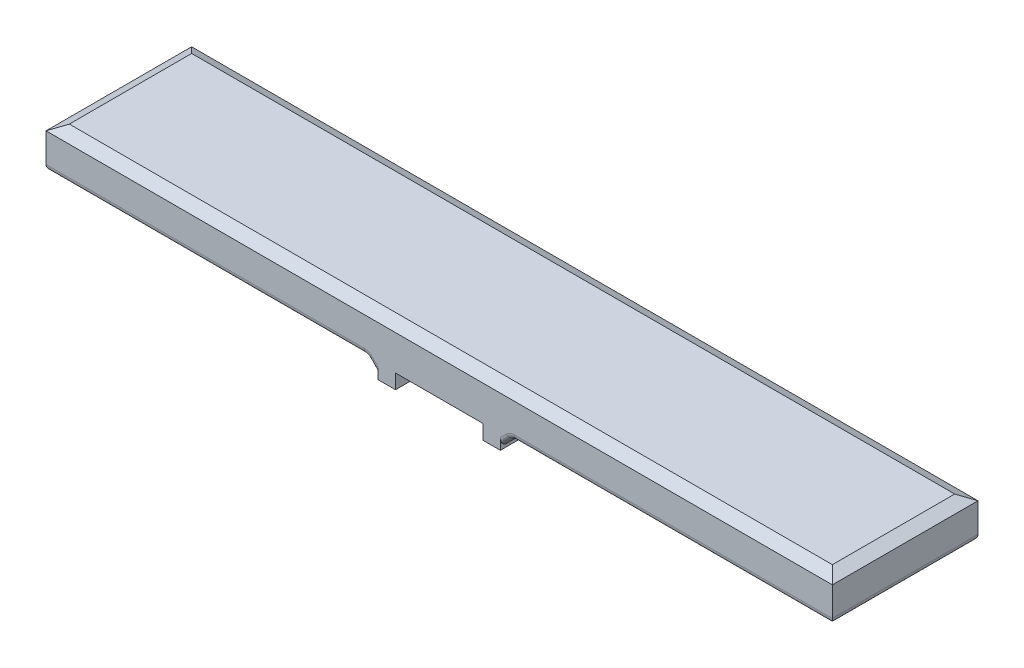
from build123d import *
from OCP.BRepFilletAPI import BRepFilletAPI_MakeChamfer

# Parameters (mm, degrees)
SKETCH1_W           = 1350
SKETCH1_H           = 250
BOSS_EXTRUDE1_DEPTH = 70
CHAMFER1_SIZE       = 10
CHAMFER1_SIZE2      = 20
SHELL1_T            = 10
SKETCH2_W           = 30
SKETCH2_H           = 250
BOSS_EXTRUDE2_DEPTH = 25
CHAMFER2_SIZE       = 20
FILLET1_R           = 10
SKETCH3_R           = 10
BOSS_EXTRUDE3_DEPTH = 25
CHAMFER3_SIZE       = 3


with BuildPart() as part:
    # Sketch1 → Boss-Extrude1 (new body)
    with BuildSketch(Plane(origin=(0, 0, 0), x_dir=(1, 0, 0), z_dir=(0, 1, 0))):
        Rectangle(SKETCH1_W, SKETCH1_H)
    extrude(amount=BOSS_EXTRUDE1_DEPTH)

    # Chamfer1: one chamfer whose edges measure the first distance from different faces: ONE call of the kernel's chamfer builder (chamfer() names one face for all edges)
    chamfer1_edges_1 = [part.edges().sort_by_distance(p)[0] for p in [
        (675, 70, 0),
    ]]
    chamfer1_side_1 = [part.faces().sort_by_distance(p)[0] for p in [
        (675, 35, 0),
    ]]
    chamfer1_edges_2 = [part.edges().sort_by_distance(p)[0] for p in [
        (0, 70, -125),
    ]]
    chamfer1_side_2 = [part.faces().sort_by_distance(p)[0] for p in [
        (0, 35, -125),
    ]]
    chamfer1_edges_3 = [part.edges().sort_by_distance(p)[0] for p in [
        (-675, 70, 0),
    ]]
    chamfer1_side_3 = [part.faces().sort_by_distance(p)[0] for p in [
        (-675, 35, 0),
    ]]
    chamfer1_edges_4 = [part.edges().sort_by_distance(p)[0] for p in [
        (0, 70, 125),
    ]]
    chamfer1_side_4 = [part.faces().sort_by_distance(p)[0] for p in [
        (0, 35, 125),
    ]]
    chamfer1 = BRepFilletAPI_MakeChamfer(part.part.solid().wrapped)
    for e in chamfer1_edges_1:
        chamfer1.Add(CHAMFER1_SIZE, CHAMFER1_SIZE2, e.wrapped, chamfer1_side_1[0].wrapped)  # the first distance lies on this face
    for e in chamfer1_edges_2:
        chamfer1.Add(CHAMFER1_SIZE, CHAMFER1_SIZE2, e.wrapped, chamfer1_side_2[0].wrapped)  # the first distance lies on this face
    for e in chamfer1_edges_3:
        chamfer1.Add(CHAMFER1_SIZE, CHAMFER1_SIZE2, e.wrapped, chamfer1_side_3[0].wrapped)  # the first distance lies on this face
    for e in chamfer1_edges_4:
        chamfer1.Add(CHAMFER1_SIZE, CHAMFER1_SIZE2, e.wrapped, chamfer1_side_4[0].wrapped)  # the first distance lies on this face
    add(Compound.cast(chamfer1.Shape()), mode=Mode.REPLACE)

    # Shell1 (no face opened: a closed hollow body)
    add(offset(amount=-SHELL1_T, mode=Mode.PRIVATE), mode=Mode.SUBTRACT)

    # Sketch2 → Boss-Extrude2 (add)
    with BuildSketch(Plane.XZ):
        with Locations((-90, 0)):
            Rectangle(SKETCH2_W, SKETCH2_H)
        with Locations((90, 0)):
            Rectangle(SKETCH2_W, SKETCH2_H)
    extrude(amount=BOSS_EXTRUDE2_DEPTH)

    # Chamfer2
    chamfer2_edges = [part.edges().sort_by_distance(p)[0] for p in [
        (-105, 0, 0),
        (105, 0, 0),
    ]]
    chamfer(chamfer2_edges, length=CHAMFER2_SIZE)

    # Fillet1
    fillet1_edges = [part.edges().sort_by_distance(p)[0] for p in [
        (-400, 0, -125),
        (675, 0, 0),
        (-400, 0, 125),
        (-675, 0, 0),
        (-125, 0, 0),
        (400, 0, -125),
        (400, 0, 125),
        (125, 0, 0),
        (-115, -10, -125),
        (-115, -10, 125),
        (115, -10, 125),
        (115, -10, -125),
    ]]
    fillet(fillet1_edges, radius=FILLET1_R)

    # Sketch3 → Boss-Extrude3 (add)
    with BuildSketch(Plane.XZ):
        with Locations(Location((0, 0, 0), (0, 0, 90))):
            Circle(SKETCH3_R)
    extrude(amount=BOSS_EXTRUDE3_DEPTH)

    # Chamfer3
    chamfer3_edges = [part.edges().sort_by_distance(p)[0] for p in [
        (0, -25, -10),
    ]]
    chamfer(chamfer3_edges, length=CHAMFER3_SIZE)


solid = part.part
